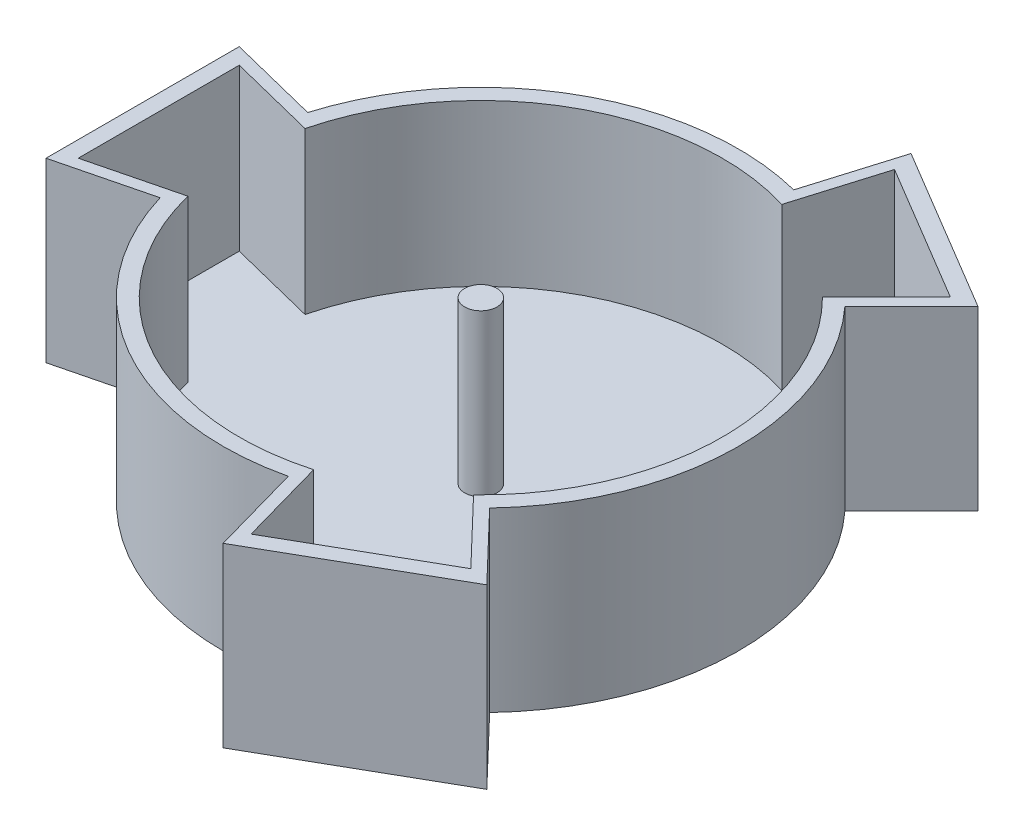
from build123d import *

# Parameters (mm, degrees)
EXTRUDE_1_DEPTH = 25.4
EXTRUDE_START   = -2.54
EXTRUDE_3_DEPTH = 2.54
SKETCH_3_R      = 2.54
EXTRUDE_4_DEPTH = 25.4


with BuildPart() as part:
    # 草图2 → 凸台-拉伸1 (new body)
    with BuildSketch(Plane(origin=(0, 0, 0), x_dir=(1, 0, 0), z_dir=(0, 1, 0))):
        with BuildLine():
            Line((-38.937567428, 11.639391857), (-53.34, 15.24))
            Line((-53.34, 15.24), (-53.34, -15.24))
            Line((-53.34, -15.24), (-38.937567428, -11.639391857))
            ThreePointArc((-38.937567428, -11.639391857), (-20.39841157, -35.149884857), (9.2123832, -39.582086804))
            Line((9.2123832, -39.582086804), (13.231701545, -53.873326185))
            Line((13.231701545, -53.873326185), (39.695843447, -38.751170473))
            Line((39.695843447, -38.751170473), (29.424096964, -28.032697299))
            ThreePointArc((29.424096964, -28.032697299), (40.638229061, -0.379392686), (29.942341184, 27.478460736))
            Line((29.942341184, 27.478460736), (40.412412109, 38.003291273))
            Line((40.412412109, 38.003291273), (14.235214892, 53.616898987))
            Line((14.235214892, 53.616898987), (9.949778446, 39.403191608))
            ThreePointArc((9.949778446, 39.403191608), (-20.069382693, 35.338781506), (-38.937567428, 11.639391857))
        make_face()
        with BuildLine():
            Line((10.998151919, 36.478084576), (15.115514017, 50.134331909))
            Line((15.115514017, 50.134331909), (36.929845031, 37.122992148))
            Line((36.929845031, 37.122992148), (26.870409141, 27.010944311))
            ThreePointArc((26.870409141, 27.010944311), (35.180765969, 14.626130926), (38.1, 0))
            ThreePointArc((38.1, 0), (35.042691409, -14.953921854), (26.361428934, -27.507909127))
            Line((26.361428934, -27.507909127), (36.230318646, -37.806004957))
            Line((36.230318646, -37.806004957), (14.176867061, -50.407801384))
            Line((14.176867061, -50.407801384), (10.315185941, -36.677062846))
            ThreePointArc((10.315185941, -36.677062846), (-19.123510847, -32.953017053), (-36.962429256, -9.240607314))
            Line((-36.962429256, -9.240607314), (-50.8, -12.7))
            Line((-50.8, -12.7), (-50.8, 12.7))
            Line((-50.8, 12.7), (-36.962429256, 9.240607314))
            ThreePointArc((-36.962429256, 9.240607314), (-18.815046274, 33.130107662), (10.998151919, 36.478084576))
        make_face(mode=Mode.SUBTRACT)
    extrude(amount=EXTRUDE_1_DEPTH)

    # 草图2<4> → 凸台-拉伸3 (add)
    with BuildSketch(Plane(origin=(0, 0, 0), x_dir=(1, 0, 0), z_dir=(0, 1, 0)).offset(EXTRUDE_START)):
        with BuildLine():
            Line((-38.937567428, 11.639391857), (-53.34, 15.24))
            Line((-53.34, 15.24), (-53.34, -15.24))
            Line((-53.34, -15.24), (-38.937567428, -11.639391857))
            ThreePointArc((-38.937567428, -11.639391857), (-20.39841157, -35.149884857), (9.2123832, -39.582086804))
            Line((9.2123832, -39.582086804), (13.231701545, -53.873326185))
            Line((13.231701545, -53.873326185), (39.695843447, -38.751170473))
            Line((39.695843447, -38.751170473), (29.424096964, -28.032697299))
            ThreePointArc((29.424096964, -28.032697299), (40.638229061, -0.379392686), (29.942341184, 27.478460736))
            Line((29.942341184, 27.478460736), (40.412412109, 38.003291273))
            Line((40.412412109, 38.003291273), (14.235214892, 53.616898987))
            Line((14.235214892, 53.616898987), (9.949778446, 39.403191608))
            ThreePointArc((9.949778446, 39.403191608), (-20.069382693, 35.338781506), (-38.937567428, 11.639391857))
        make_face()
    extrude(amount=EXTRUDE_3_DEPTH)

    # 草图3 → 凸台-拉伸4 (add)
    with BuildSketch(Plane(origin=(0, 0, 0), x_dir=(1, 0, 0), z_dir=(0, 1, 0))):
        Circle(SKETCH_3_R)
    extrude(amount=EXTRUDE_4_DEPTH)


solid = part.part
